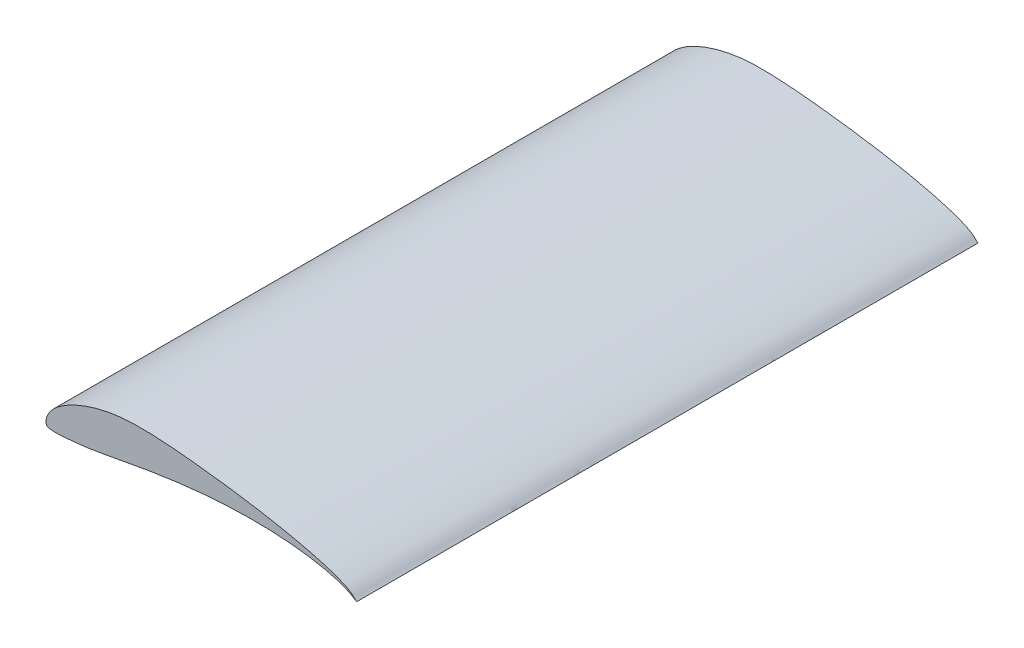
from build123d import *

# Parameters (mm, degrees)
BOSS_EXTRUDE1_DEPTH = 254


with BuildPart() as part:
    # Sketch1 → Boss-Extrude1 (new body)
    with BuildSketch(Plane.XY):
        with BuildLine():
            add(Edge.make_bspline(
                [(127, 0), (127.000769717, 0.003231117), (126.584141572, 0.315526649), (126.232031088, 0.663013823), (125.450071515, 1.388943816), (124.527299188, 2.161457643), (123.264224262, 2.941200751), (121.692964679, 3.697864805), (119.795728435, 4.48828045), (117.575379307, 5.301510046), (115.042270285, 6.131824162), (112.209543307, 6.97203931), (109.093063037, 7.818204488), (105.710028463, 8.662583323), (102.079831769, 9.49907815), (98.22410914, 10.322467233), (94.166407675, 11.128506938), (89.930427966, 11.907354391), (85.542855574, 12.657837125), (81.028961239, 13.370381609), (76.417953477, 14.046269182), (71.739380437, 14.680164009), (67.027136306, 15.269982894), (62.318917037, 15.819696415), (57.653673369, 16.315664975), (53.069397572, 16.748748707), (48.598271852, 17.095224919), (44.265790845, 17.337193772), (40.095985296, 17.448340328), (36.110277981, 17.449329203), (32.315886726, 17.265158631), (28.711296442, 16.880123989), (25.281944191, 16.330853073), (22.026998321, 15.615839951), (18.949916921, 14.77524626), (16.063752645, 13.824080156), (13.380833212, 12.784744347), (10.917828002, 11.66280057), (8.68269162, 10.481149213), (6.687604337, 9.253266247), (4.945103544, 7.995832508), (3.455984133, 6.735605419), (2.24174793, 5.458719382), (1.3081866, 4.176245928), (0.617717297, 2.927939821), (0.174083024, 1.742118953), (-0.038842725, 0.647037814), (-0.00103636, -0.279771872), (0.235084444, -1.130388706), (1.120705673, -1.554865008), (2.312905465, -1.61750848), (3.943898654, -1.679598961), (5.995452501, -1.597079408), (8.444175705, -1.441609295), (11.262890426, -1.189385903), (14.422744043, -0.846224082), (17.90835513, -0.404519448), (21.718252977, 0.215901377), (25.870922962, 0.995707518), (30.386852428, 1.844395573), (35.243916984, 2.740231225), (40.411516395, 3.645536297), (45.851619235, 4.525884551), (51.521954327, 5.351475446), (57.373586594, 6.091562961), (63.353849853, 6.724256839), (69.406186087, 7.220540046), (75.469834819, 7.567211523), (81.481415793, 7.750045396), (87.375688495, 7.758277376), (93.086888922, 7.590379402), (98.549625687, 7.250084305), (103.698210978, 6.741768927), (108.471385615, 6.084550228), (112.807034181, 5.297277151), (116.654371921, 4.406043181), (119.942573777, 3.454781263), (122.632949536, 2.441882935), (124.551876796, 1.516523121), (125.966151881, 0.661946326), (126.509448596, 0.331250793), (126.999214635, -0.003296806), (127, 0)],
                knots=[0, 0, 0, 0, 0.000979678, 0.003648862, 0.007483499, 0.012095277, 0.017525591, 0.02405178, 0.031783051, 0.040677828, 0.050710301, 0.061833229, 0.07398925, 0.087118173, 0.101145049, 0.115990637, 0.131570422, 0.147788379, 0.164550917, 0.181757895, 0.199311955, 0.217095072, 0.234990228, 0.252856883, 0.270540594, 0.287886779, 0.304773438, 0.321101419, 0.336806063, 0.351800033, 0.366031063, 0.379615675, 0.392652963, 0.405170359, 0.417171919, 0.428603517, 0.439418959, 0.449596586, 0.459102079, 0.467907878, 0.475988301, 0.483308969, 0.489874508, 0.49580325, 0.501149412, 0.505903073, 0.510046769, 0.513579311, 0.516446927, 0.519350053, 0.523823355, 0.529973794, 0.537715654, 0.546967844, 0.557637367, 0.569620481, 0.582804124, 0.597246961, 0.613135037, 0.6304436, 0.649056124, 0.668822257, 0.689594964, 0.711189651, 0.733426689, 0.756094118, 0.778988554, 0.801889683, 0.824566598, 0.846792285, 0.868338291, 0.888978163, 0.908492011, 0.926658768, 0.943286193, 0.95816921, 0.971135822, 0.981955623, 0.990251791, 0.995852565, 0.999000406, 1, 1, 1, 1], degree=3))
        make_face()
    extrude(amount=BOSS_EXTRUDE1_DEPTH)


solid = part.part
